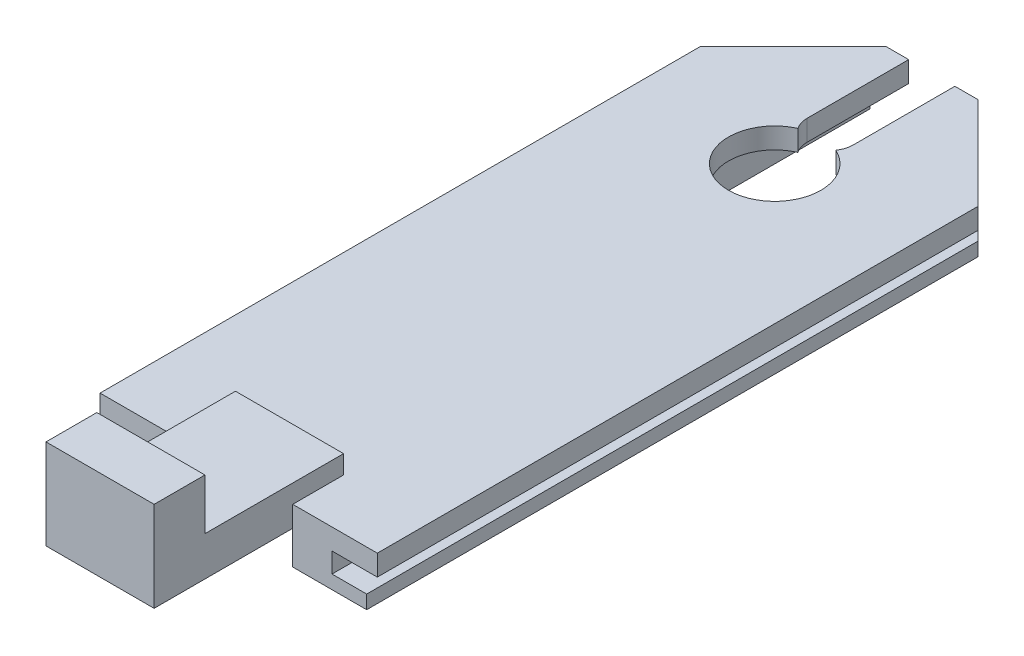
from build123d import *

# Parameters (mm, degrees)
BOSS_EXTRUDE1_DEPTH = 75
CUT_EXTRUDE1_DEPTH  = 2.25
SKETCH3_W           = 11.7
SKETCH3_H           = 2.25
BOSS_EXTRUDE2_DEPTH = 15
SKETCH4_W           = 11.7
SKETCH4_H           = 5.5
BOSS_EXTRUDE3_DEPTH = 7.5
SKETCH5_W           = 11.7
SKETCH5_H           = 2
BOSS_EXTRUDE4_DEPTH = 15
SKETCH6_R           = 5
CUT_EXTRUDE2_DEPTH  = 2.25
CHAMFER1_SIZE       = 10
CHAMFER2_SIZE       = 10


with BuildPart() as part:
    # Sketch1 → Boss-Extrude1 (new body)
    with BuildSketch(Plane.XY):
        Polygon((-15, 0), (15, 0), (15, -2.25), (10.1, -2.25), (10.1, -4.41), (13.85, -4.41), (13.85, -5.88), (5.85, -5.88), (5.85, -2.25), (-5.85, -2.25), (-5.85, -5.88), (-13.85, -5.88), (-13.85, -4.41), (-10.1, -4.41), (-10.1, -2.25), (-15, -2.25), align=None)
    extrude(amount=BOSS_EXTRUDE1_DEPTH)

    # Sketch2 → Cut-Extrude1 (cut)
    with BuildSketch(Plane(origin=(0, 0, 0), x_dir=(1, 0, 0), z_dir=(0, 1, 0))):
        with BuildLine():
            Line((2.5, -11), (2.5, 0))
            Line((2.5, 0), (-2.5, 0))
            Line((-2.5, 0), (-2.5, -11))
            ThreePointArc((-2.5, -11), (0, -13.5), (2.5, -11))
        make_face()
    extrude(amount=-CUT_EXTRUDE1_DEPTH, mode=Mode.SUBTRACT)

    # Sketch3 → Boss-Extrude2 (add)
    with BuildSketch(Plane.XY.offset(75)):
        with Locations((0, -1.125)):
            Rectangle(SKETCH3_W, SKETCH3_H)
    extrude(amount=BOSS_EXTRUDE2_DEPTH)

    # Sketch4 → Boss-Extrude3 (add)
    with BuildSketch(Plane(origin=(0, 0, 0), x_dir=(1, 0, 0), z_dir=(0, 1, 0))):
        with Locations((0, -87.25)):
            Rectangle(SKETCH4_W, SKETCH4_H)
    extrude(amount=BOSS_EXTRUDE3_DEPTH)

    # Sketch5 → Boss-Extrude4 (add)
    with BuildSketch(Plane(origin=(0, 0, 84.5), x_dir=(-1, 0, 0), z_dir=(0, 0, -1))):
        with Locations((0, 1)):
            Rectangle(SKETCH5_W, SKETCH5_H)
    extrude(amount=BOSS_EXTRUDE4_DEPTH)

    # Sketch6 → Cut-Extrude2 (cut)
    with BuildSketch(Plane(origin=(0, 0, 0), x_dir=(1, 0, 0), z_dir=(0, 1, 0))):
        with Locations((0, -17)):
            Circle(SKETCH6_R)
    extrude(amount=-CUT_EXTRUDE2_DEPTH, mode=Mode.SUBTRACT)

    # Chamfer1
    chamfer1_edges = [part.edges().sort_by_distance(p)[0] for p in [
        (15, -1.125, 0),
    ]]
    chamfer(chamfer1_edges, length=CHAMFER1_SIZE)

    # Chamfer2
    chamfer2_edges = [part.edges().sort_by_distance(p)[0] for p in [
        (-15, -1.125, 0),
    ]]
    chamfer(chamfer2_edges, length=CHAMFER2_SIZE)


solid = part.part
